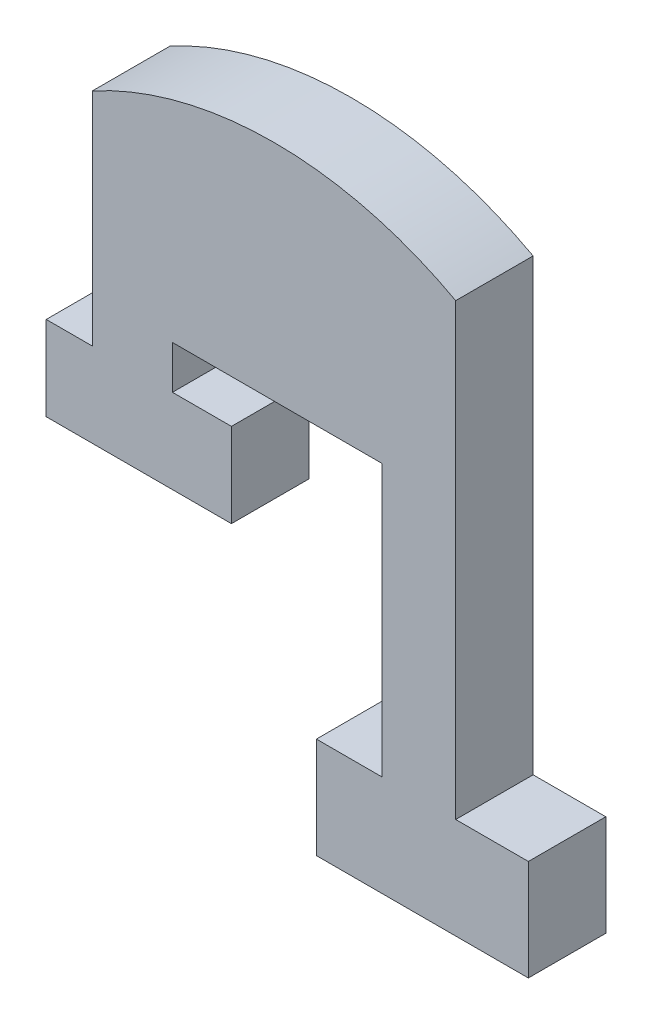
from build123d import *

# Parameters (mm, degrees)
BOSS_EXTRUDE1_DEPTH = 20
SKETCH3_W           = 47.8415773
SKETCH3_H           = 21.769183321
SKETCH3_W_2         = 54.74945498
SKETCH3_H_2         = 26.072393978
BOSS_EXTRUDE2_DEPTH = 20


with BuildPart() as part:
    # Sketch1 → Boss-Extrude1 (new body)
    with BuildSketch(Plane.XY):
        with BuildLine():
            ThreePointArc((-57.85830676, 45.936170213), (-10.937790042, 57.86666983), (35.982726675, 45.936170213))
            Line((35.982726675, 45.936170213), (35.982726675, -85.966261398))
            Line((35.982726675, -85.966261398), (16.952027587, -85.966261398))
            Line((16.952027587, -85.966261398), (16.952027587, 0))
            Line((16.952027587, 0), (-37.187030164, 0))
            Line((-37.187030164, 0), (-37.187030164, -22.639969605))
            Line((-37.187030164, -22.639969605), (-57.85830676, -22.639969605))
            Line((-57.85830676, -22.639969605), (-57.85830676, 0))
            Line((-57.85830676, 0), (-57.85830676, 45.936170213))
        make_face()
    extrude(amount=BOSS_EXTRUDE1_DEPTH)

    # Sketch3 → Boss-Extrude2 (add)
    with BuildSketch(Plane.XY):
        with Locations((-45.869735372, -22.040085901)):
            Rectangle(SKETCH3_W, SKETCH3_H)
        with Locations((27.37472749, -83.170990229)):
            Rectangle(SKETCH3_W_2, SKETCH3_H_2)
    extrude(amount=BOSS_EXTRUDE2_DEPTH)


solid = part.part
